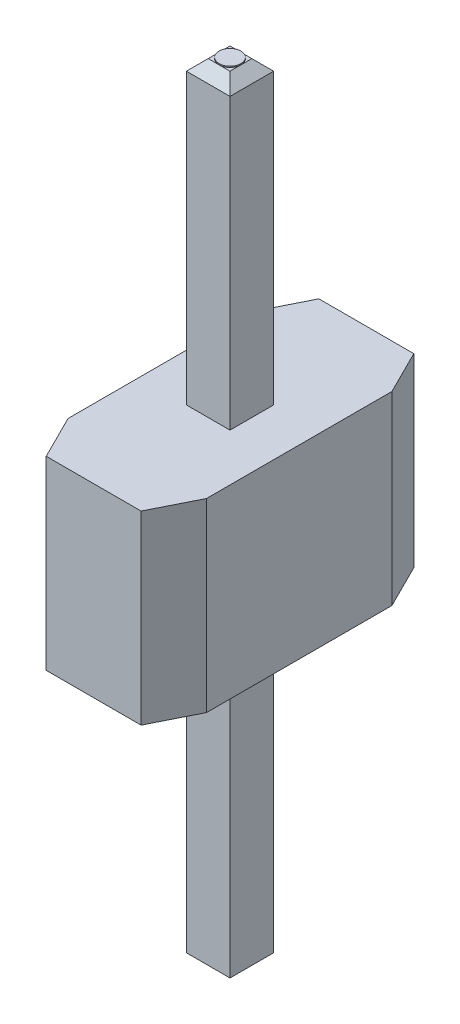
from build123d import *

# Parameters (mm, degrees)
EXTRUDE_1_DEPTH      = 1.7
EXTRUDE_2_DEPTH      = 2.75
EXTRUDE_2_DEPTH_BACK = 4.45
CHAMFER_1_SIZE       = 0.1
CHAMFER_2_SIZE       = 0.1
SKETCH_3_R           = 0.1
EXTRUDE_3_DEPTH      = 0.01


with BuildPart() as part:
    # 草图1 → 凸台-拉伸1 (new body)
    with BuildSketch(Plane(origin=(0, 0, 0), x_dir=(1, 0, 0), z_dir=(0, 1, 0))):
        Polygon((8.059615848, 1.144344533), (8.059615848, 2.844344533), (8.259615848, 3.244344533), (9.129615848, 3.244344533), (9.329615848, 2.844344533), (9.329615848, 1.144344533), (9.129615848, 0.744344533), (8.259615848, 0.744344533), align=None)
    extrude(amount=EXTRUDE_1_DEPTH)

    # 草图2 → 凸台-拉伸2 (add, two sides: drawn at the far end of the back side and taken through both)
    with BuildSketch(Plane(origin=(0, 1.7, 0), x_dir=(1, 0, 0), z_dir=(0, 1, 0)).offset(-EXTRUDE_2_DEPTH_BACK)):
        Polygon((8.694615848, 2.194344533), (8.494615848, 2.194344533), (8.494615848, 1.794344533), (8.894615848, 1.794344533), (8.894615848, 2.194344533), align=None)
    extrude(amount=EXTRUDE_2_DEPTH + EXTRUDE_2_DEPTH_BACK)

    # 倒角1
    chamfer_1_edges = [part.edges().sort_by_distance(p)[0] for p in [
        (8.694615848, 4.45, -2.194344533),
        (8.494615848, 4.45, -1.994344533),
        (8.694615848, 4.45, -1.794344533),
        (8.894615848, 4.45, -1.994344533),
    ]]
    chamfer(chamfer_1_edges, length=CHAMFER_1_SIZE)

    # 倒角2
    chamfer_2_edges = [part.edges().sort_by_distance(p)[0] for p in [
        (8.894615848, -2.75, -1.994344533),
        (8.694615848, -2.75, -1.794344533),
        (8.494615848, -2.75, -1.994344533),
        (8.694615848, -2.75, -2.194344533),
    ]]
    chamfer(chamfer_2_edges, length=CHAMFER_2_SIZE)

    # 草图3 → 凸台-拉伸3 (add)
    with BuildSketch(Plane(origin=(0, 4.45, 0), x_dir=(1, 0, 0), z_dir=(0, 1, 0))):
        with Locations(Location((8.694615848, 1.994344533, 0), (0, 0, 270))):
            Circle(SKETCH_3_R)
    extrude(amount=EXTRUDE_3_DEPTH)


solid = part.part
